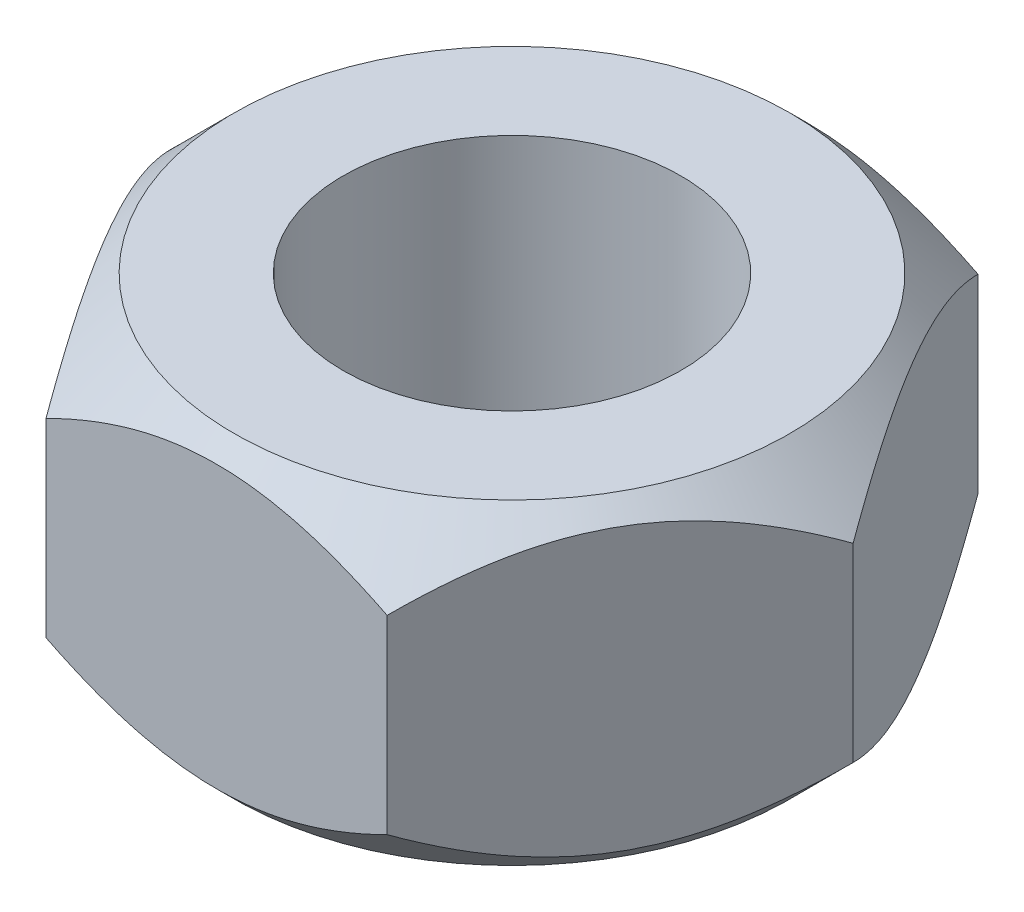
from build123d import *

# Parameters (mm, degrees)
BOSS_EXTRUDE1_DEPTH     = 7.5
CUT_EXTRUDE1_DEPTH      = 27.121510931
CUT_EXTRUDE1_DEPTH_BACK = 27.121510931
SKETCH4_R               = 8


with BuildPart() as part:
    # Sketch2 → Boss-Extrude1 (new, symmetric)
    with BuildSketch(Plane(origin=(0, 0, 0), x_dir=(1, 0, 0), z_dir=(0, 1, 0))):
        Polygon((8.082903769, 14), (-8.082903769, 14), (-16.165807537, 0), (-8.082903769, -14), (8.082903769, -14), (16.165807537, 0), align=None)
    extrude(amount=BOSS_EXTRUDE1_DEPTH, both=True)

    # Sketch3 → Cut-Revolve1 (revolve, cut)
    with BuildSketch(Plane.XY, mode=Mode.PRIVATE) as cut_revolve1_sk:
        Polygon((13.165807537, 7.5), (16.165807537, 7.5), (16.165807537, 4.5), align=None)
    cut_revolve1 = revolve(cut_revolve1_sk.sketch.rotate(Axis((0, 0, 0), (0, 1, 0)), 90), axis=Axis((0, 0, 0), (0, 1, 0)), mode=Mode.SUBTRACT)

    # Mirror1: Cut-Revolve1 across plane
    add(cut_revolve1.mirror(Plane.ZX), mode=Mode.SUBTRACT)

    # Sketch4 → Cut-Extrude1 (cut, two sides: drawn at the far end of the back side and taken through both)
    with BuildSketch(Plane(origin=(0, 7.5, 0), x_dir=(1, 0, 0), z_dir=(0, 1, 0)).offset(-CUT_EXTRUDE1_DEPTH_BACK)):
        with Locations(Location((0, 0, 0), (0, 0, 270))):
            Circle(SKETCH4_R)
    extrude(amount=CUT_EXTRUDE1_DEPTH + CUT_EXTRUDE1_DEPTH_BACK, mode=Mode.SUBTRACT)


solid = part.part
